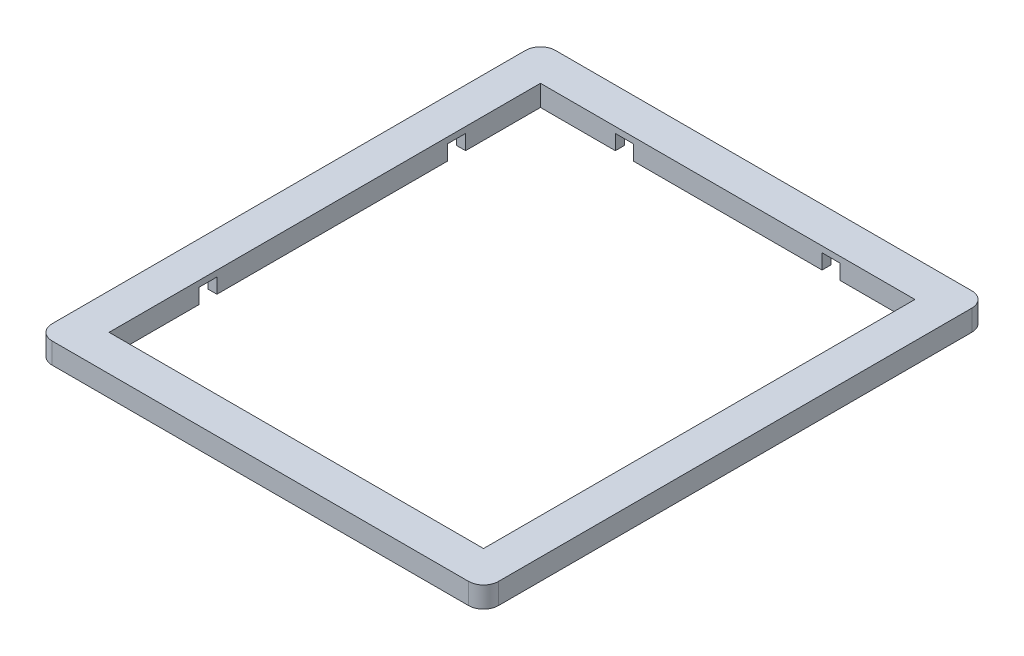
from build123d import *

# Parameters (mm, degrees)
SKETCH1_W           = 149
SKETCH1_H           = 168
SKETCH1_W_2         = 125
SKETCH1_H_2         = 144
BOSS_EXTRUDE1_DEPTH = 7
FILLET1_R           = 5
FILLET2_R           = 5
FILLET3_R           = 5
FILLET4_R           = 5
CUT_EXTRUDE1_DEPTH  = 3
SKETCH6_R           = 1.325
CUT_EXTRUDE2_DEPTH  = 4
CUT_EXTRUDE3_DEPTH  = 2


with BuildPart() as part:
    # Sketch1 → Boss-Extrude1 (new body)
    with BuildSketch(Plane(origin=(0, 0, 0), x_dir=(1, 0, 0), z_dir=(0, 1, 0))):
        with Locations((-8.812010444, -5.018276762)):
            Rectangle(SKETCH1_W, SKETCH1_H)
        with Locations((-8.812010444, -5.018276762)):
            Rectangle(SKETCH1_W_2, SKETCH1_H_2, mode=Mode.SUBTRACT)
    extrude(amount=BOSS_EXTRUDE1_DEPTH)

    # Fillet1
    fillet1_edges = [part.edges().sort_by_distance(p)[0] for p in [
        (65.687989556, 3.5, 89.018276762),
    ]]
    fillet(fillet1_edges, radius=FILLET1_R)

    # Fillet2
    fillet2_edges = [part.edges().sort_by_distance(p)[0] for p in [
        (-83.312010444, 3.5, 89.018276762),
    ]]
    fillet(fillet2_edges, radius=FILLET2_R)

    # Fillet3
    fillet3_edges = [part.edges().sort_by_distance(p)[0] for p in [
        (-83.312010444, 3.5, -78.981723238),
    ]]
    fillet(fillet3_edges, radius=FILLET3_R)

    # Fillet4
    fillet4_edges = [part.edges().sort_by_distance(p)[0] for p in [
        (65.687989556, 3.5, -78.981723238),
    ]]
    fillet(fillet4_edges, radius=FILLET4_R)

    # Sketch4 → Cut-Extrude1 (cut)
    with BuildSketch(Plane.XZ):
        Polygon((-40.312010444, 80.018276762), (-25.812010444, 80.018276762), (-25.812010444, 84.518276762), (-60.812010444, 84.518276762), (-60.812010444, 80.018276762), (-46.312010444, 80.018276762), (-46.312010444, 77.018276762), (-40.312010444, 77.018276762), align=None)
        Polygon((22.687989556, 77.018276762), (22.687989556, 80.018276762), (8.187989556, 80.018276762), (8.187989556, 84.518276762), (43.187989556, 84.518276762), (43.187989556, 80.018276762), (28.687989556, 80.018276762), (28.687989556, 77.018276762), align=None)
        Polygon((53.687989556, 47.018276762), (56.687989556, 47.018276762), (56.687989556, 66.518276762), (61.187989556, 66.518276762), (61.187989556, 21.518276762), (56.687989556, 21.518276762), (56.687989556, 41.018276762), (53.687989556, 41.018276762), align=None)
        Polygon((53.687989556, -35.981723238), (56.687989556, -35.981723238), (56.687989556, -13.981723238), (61.187989556, -13.981723238), (61.187989556, -63.981723238), (56.687989556, -63.981723238), (56.687989556, -41.981723238), (53.687989556, -41.981723238), align=None)
        Polygon((43.187989556, -69.981723238), (43.187989556, -74.481723238), (8.187989556, -74.481723238), (8.187989556, -69.981723238), (22.687989556, -69.981723238), (22.687989556, -66.981723238), (28.687989556, -66.981723238), (28.687989556, -69.981723238), align=None)
        Polygon((-40.312010444, -66.981723238), (-40.312010444, -69.981723238), (-25.812010444, -69.981723238), (-25.812010444, -74.481723238), (-60.812010444, -74.481723238), (-60.812010444, -69.981723238), (-46.312010444, -69.981723238), (-46.312010444, -66.981723238), align=None)
        Polygon((-71.312010444, -41.981723238), (-74.312010444, -41.981723238), (-74.312010444, -63.981723238), (-78.812010444, -63.981723238), (-78.812010444, -13.981723238), (-74.312010444, -13.981723238), (-74.312010444, -35.981723238), (-71.312010444, -35.981723238), align=None)
        Polygon((-71.312010444, 41.018276762), (-74.312010444, 41.018276762), (-74.312010444, 21.518276762), (-78.812010444, 21.518276762), (-78.812010444, 66.518276762), (-74.312010444, 66.518276762), (-74.312010444, 47.018276762), (-71.312010444, 47.018276762), align=None)
    extrude(amount=-CUT_EXTRUDE1_DEPTH, mode=Mode.SUBTRACT)

    # Sketch6 → Cut-Extrude2 (cut)
    with BuildSketch(Plane.XZ):
        with Locations(Location((-76.579777397, 82.286043715, 0), (0, 0, 270))):
            Circle(SKETCH6_R)
        with Locations(Location((58.955756509, 82.286043715, 0), (0, 0, 270))):
            Circle(SKETCH6_R)
        with Locations(Location((58.955756509, -72.249490191, 0), (0, 0, 270))):
            Circle(SKETCH6_R)
        with Locations(Location((-76.579777397, -72.249490191, 0), (0, 0, 270))):
            Circle(SKETCH6_R)
    extrude(amount=-CUT_EXTRUDE2_DEPTH, mode=Mode.SUBTRACT)

    # Sketch7 → Cut-Extrude3 (cut)
    with BuildSketch(Plane.XZ.offset(-3)):
        Polygon((53.687989556, -35.981723238), (56.687989556, -35.981723238), (56.687989556, -30.981723238), (61.187989556, -30.981723238), (61.187989556, -46.981723238), (56.687989556, -46.981723238), (56.687989556, -41.981723238), (53.687989556, -41.981723238), align=None)
        Polygon((53.687989556, 47.018276762), (56.687989556, 47.018276762), (56.687989556, 52.018276762), (61.187989556, 52.018276762), (61.187989556, 36.018276762), (56.687989556, 36.018276762), (56.687989556, 41.018276762), (53.687989556, 41.018276762), align=None)
        Polygon((28.687989556, 77.018276762), (28.687989556, 80.018276762), (33.687989556, 80.018276762), (33.687989556, 84.518276762), (17.687989556, 84.518276762), (17.687989556, 80.018276762), (22.687989556, 80.018276762), (22.687989556, 77.018276762), align=None)
        Polygon((-40.312010444, 77.018276762), (-40.312010444, 80.018276762), (-35.312010444, 80.018276762), (-35.312010444, 84.518276762), (-51.312010444, 84.518276762), (-51.312010444, 80.018276762), (-46.312010444, 80.018276762), (-46.312010444, 77.018276762), align=None)
        Polygon((-71.312010444, 47.018276762), (-74.312010444, 47.018276762), (-74.312010444, 52.018276762), (-78.812010444, 52.018276762), (-78.812010444, 36.018276762), (-74.312010444, 36.018276762), (-74.312010444, 41.018276762), (-71.312010444, 41.018276762), align=None)
        Polygon((-71.312010444, -35.981723238), (-74.312010444, -35.981723238), (-74.312010444, -30.981723238), (-78.812010444, -30.981723238), (-78.812010444, -46.981723238), (-74.312010444, -46.981723238), (-74.312010444, -41.981723238), (-71.312010444, -41.981723238), align=None)
        Polygon((-46.312010444, -66.981723238), (-46.312010444, -69.981723238), (-51.312010444, -69.981723238), (-51.312010444, -74.481723238), (-35.312010444, -74.481723238), (-35.312010444, -69.981723238), (-40.312010444, -69.981723238), (-40.312010444, -66.981723238), align=None)
        Polygon((22.687989556, -66.981723238), (22.687989556, -69.981723238), (17.687989556, -69.981723238), (17.687989556, -74.481723238), (33.687989556, -74.481723238), (33.687989556, -69.981723238), (28.687989556, -69.981723238), (28.687989556, -66.981723238), align=None)
    extrude(amount=-CUT_EXTRUDE3_DEPTH, mode=Mode.SUBTRACT)


solid = part.part
